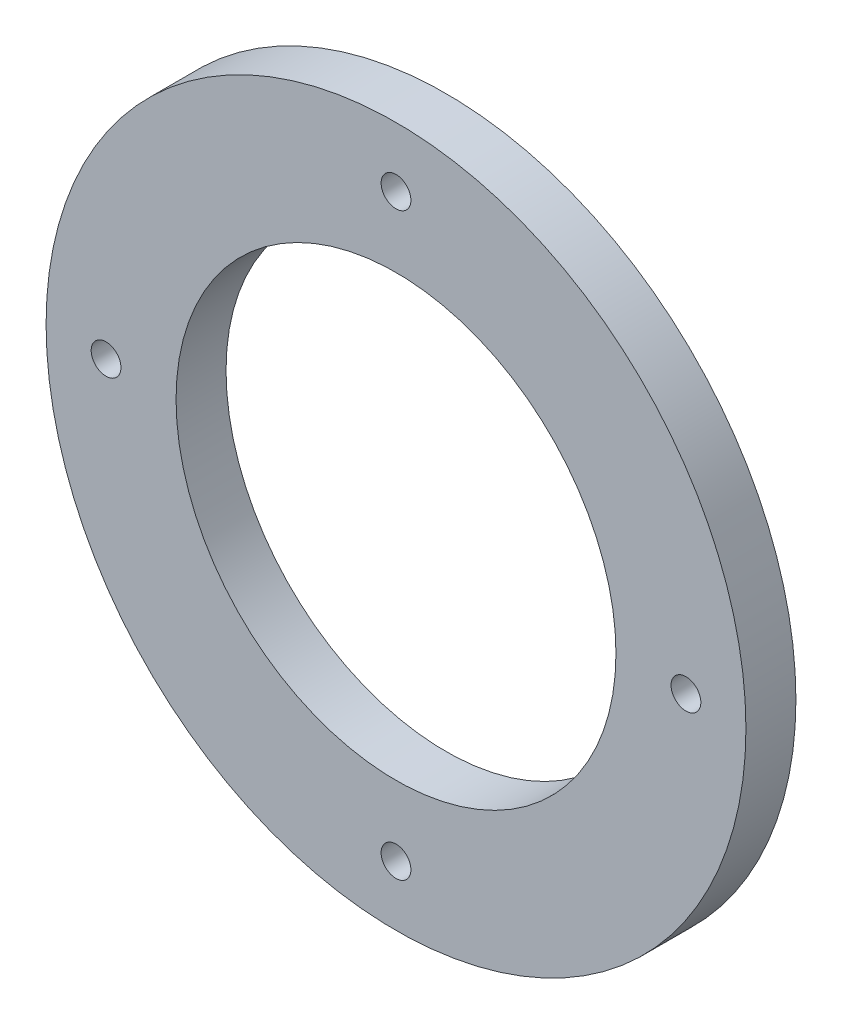
from build123d import *

# Parameters (mm, degrees)
SKETCH1_R           = 35
SKETCH1_R_2         = 22
SKETCH1_R_3         = 1.49
BOSS_EXTRUDE1_DEPTH = 5


with BuildPart() as part:
    # Sketch1 → Boss-Extrude1 (new body)
    with BuildSketch(Plane.XY):
        Circle(SKETCH1_R)
        Circle(SKETCH1_R_2, mode=Mode.SUBTRACT)
        with Locations((29, 0)):
            Circle(SKETCH1_R_3, mode=Mode.SUBTRACT)
        with Locations((0, 29)):
            Circle(SKETCH1_R_3, mode=Mode.SUBTRACT)
        with Locations((-29, 0)):
            Circle(SKETCH1_R_3, mode=Mode.SUBTRACT)
        with Locations((0, -29)):
            Circle(SKETCH1_R_3, mode=Mode.SUBTRACT)
    extrude(amount=BOSS_EXTRUDE1_DEPTH)


solid = part.part
